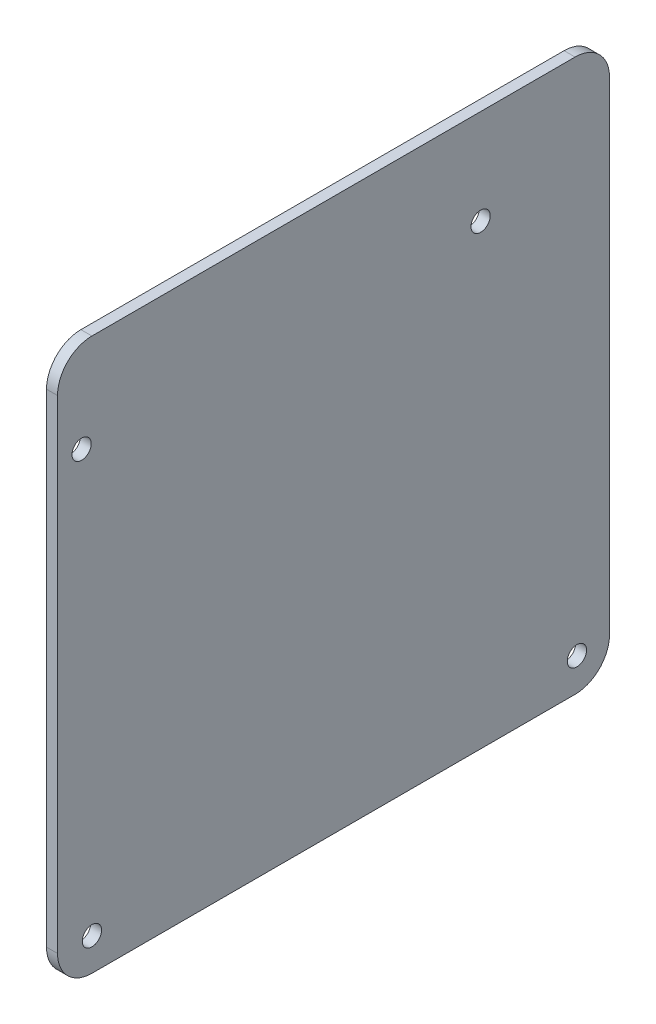
from build123d import *

# Parameters (mm, degrees)
SKETCH1_R           = 1.4
BOSS_EXTRUDE1_DEPTH = 0.8


with BuildPart() as part:
    # Sketch1 → Boss-Extrude1 (new, symmetric)
    with BuildSketch(Plane(origin=(0, 0, 0), x_dir=(0, 0, -1), z_dir=(1, 0, 0))):
        with BuildLine():
            Line((-35.115, -40.115), (35.115, -40.115))
            ThreePointArc((35.115, -40.115), (38.650533906, -38.650533906), (40.115, -35.115))
            Line((40.115, -35.115), (40.115, 35.115))
            ThreePointArc((40.115, 35.115), (38.650533906, 38.650533906), (35.115, 40.115))
            Line((35.115, 40.115), (-35.115, 40.115))
            ThreePointArc((-35.115, 40.115), (-38.650533906, 38.650533906), (-40.115, 35.115))
            Line((-40.115, 35.115), (-40.115, -35.115))
            ThreePointArc((-40.115, -35.115), (-38.650533906, -38.650533906), (-35.115, -40.115))
        make_face()
        with Locations((-36.615, 26.615)):
            Circle(SKETCH1_R, mode=Mode.SUBTRACT)
        with Locations((21.384224133, 26.315)):
            Circle(SKETCH1_R, mode=Mode.SUBTRACT)
        with Locations((35.384224133, -35.385)):
            Circle(SKETCH1_R, mode=Mode.SUBTRACT)
        with Locations((-35.115, -35.385)):
            Circle(SKETCH1_R, mode=Mode.SUBTRACT)
    extrude(amount=BOSS_EXTRUDE1_DEPTH, both=True)


solid = part.part
